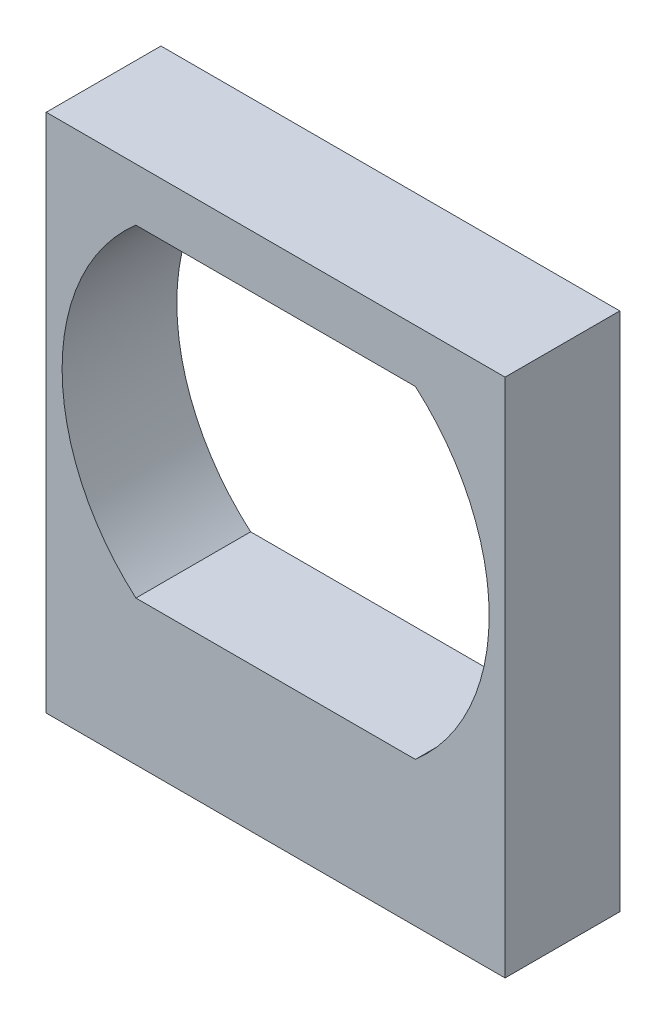
from build123d import *

# Parameters (mm, degrees)
SKETCH2_W                 = 29.487
SKETCH2_H                 = 26
BOSS_EXTRUDE1_DEPTH       = 6.5
CUT_EXTRUDE1_DEPTH        = 23.623473849
M2X0_4_TAPPED_HOLE1_D     = 1.6
M2X0_4_TAPPED_HOLE1_DEPTH = 5.2
M2X0_4_TAPPED_HOLE1_TIP   = 0.480688495


with BuildPart() as part:
    # Sketch2 → Boss-Extrude1 (new body)
    with BuildSketch(Plane(origin=(0, 0, 0), x_dir=(0, 1, 0), z_dir=(0, 0, 1))):
        with Locations((-2.5935, 0)):
            Rectangle(SKETCH2_W, SKETCH2_H)
    extrude(amount=BOSS_EXTRUDE1_DEPTH)

    # Sketch1 → Cut-Extrude1 (cut, through all)
    with BuildSketch(Plane(origin=(0, 0, 0), x_dir=(0, 1, 0), z_dir=(0, 0, 1))):
        with BuildLine():
            Line((-9.15, 7.917543811), (-9.15, -7.917543811))
            ThreePointArc((-9.15, -7.917543811), (0, -12.1), (9.15, -7.917543811))
            Line((9.15, -7.917543811), (9.15, 7.917543811))
            ThreePointArc((9.15, 7.917543811), (0, 12.1), (-9.15, 7.917543811))
        make_face()
    extrude(amount=CUT_EXTRUDE1_DEPTH, mode=Mode.SUBTRACT)

    # M2x0.4 Tapped Hole1
    with Locations(Plane.XZ.offset(17.337)):
        with Locations((0, 3.25)):
            Hole(M2X0_4_TAPPED_HOLE1_D / 2, depth=M2X0_4_TAPPED_HOLE1_DEPTH)
            with Locations((0, 0, -(M2X0_4_TAPPED_HOLE1_DEPTH + M2X0_4_TAPPED_HOLE1_TIP / 2))):  # 118° drill point
                Cone(0, M2X0_4_TAPPED_HOLE1_D / 2, M2X0_4_TAPPED_HOLE1_TIP, mode=Mode.SUBTRACT)


solid = part.part
